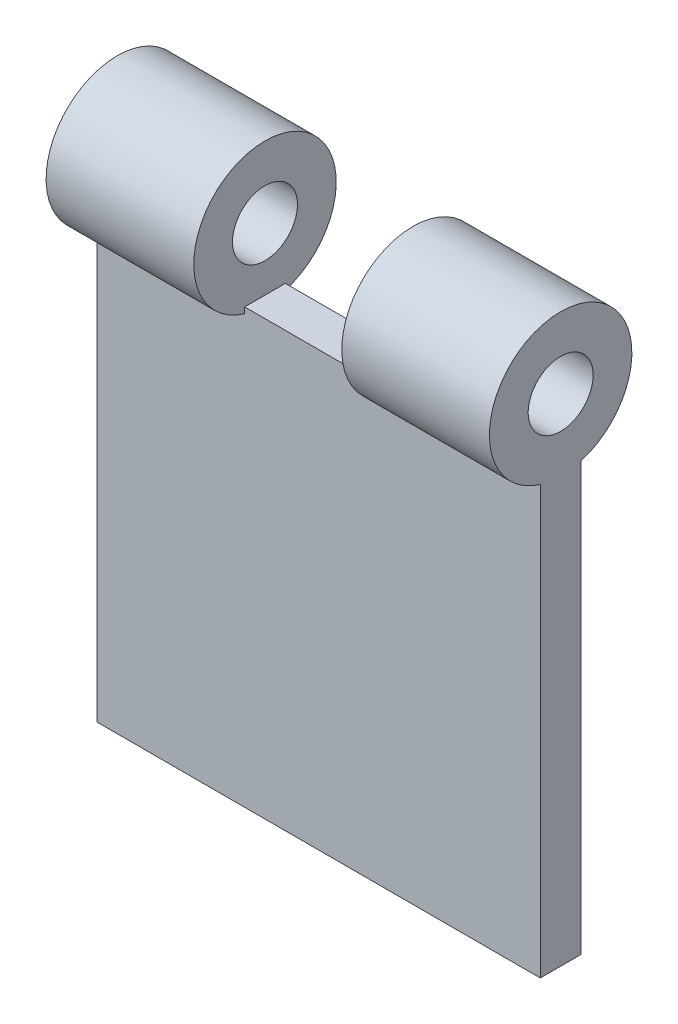
from build123d import *

# Parameters (mm, degrees)
SKETCH1_W           = 24.892
SKETCH1_H           = 7.874
BOSS_EXTRUDE1_DEPTH = 2.286
SKETCH2_R           = 4
BOSS_EXTRUDE2_DEPTH = 8.29
SKETCH3_R           = 1.825
CUT_EXTRUDE1_DEPTH  = 8.29
SKETCH4_R           = 4
BOSS_EXTRUDE3_DEPTH = 8.29
SKETCH5_R           = 1.825
CUT_EXTRUDE2_DEPTH  = 8.29
SKETCH7_W           = 2.286
SKETCH7_H           = 24
BOSS_EXTRUDE4_DEPTH = 24.892


with BuildPart() as part:
    # Sketch1 → Boss-Extrude1 (new body)
    with BuildSketch(Plane.XY):
        with Locations((-11.83196875, 3.65678125)):
            Rectangle(SKETCH1_W, SKETCH1_H)
    extrude(amount=BOSS_EXTRUDE1_DEPTH)

    # Sketch4 → Boss-Extrude3 (add)
    with BuildSketch(Plane.ZY.offset(24.27796875)):
        with Locations(Location((1.143, 11.09378125, 0), (0, 0, 90))):
            Circle(SKETCH4_R)
    extrude(amount=-BOSS_EXTRUDE3_DEPTH)

    # Sketch5 → Cut-Extrude2 (cut)
    with BuildSketch(Plane.ZY.offset(24.27796875)):
        with Locations(Location((1.143, 11.09378125, 0), (0, 0, 90))):
            Circle(SKETCH5_R)
    extrude(amount=-CUT_EXTRUDE2_DEPTH, mode=Mode.SUBTRACT)



with BuildPart() as body_2:
    # Sketch2 → Boss-Extrude2 (new body)
    with BuildSketch(Plane(origin=(0.61403125, 0, 0), x_dir=(0, 0, -1), z_dir=(1, 0, 0))):
        with Locations(Location((-1.143, 11.09378125, 0), (0, 0, 90))):
            Circle(SKETCH2_R)
    extrude(amount=-BOSS_EXTRUDE2_DEPTH)

    # Sketch3 → Cut-Extrude1 (cut)
    with BuildSketch(Plane(origin=(0.61403125, 0, 0), x_dir=(0, 0, -1), z_dir=(1, 0, 0))):
        with Locations(Location((-1.143, 11.09378125, 0), (0, 0, 90))):
            Circle(SKETCH3_R)
    extrude(amount=-CUT_EXTRUDE1_DEPTH, mode=Mode.SUBTRACT)


with BuildPart() as part_1:
    add(part.part)

    add(body_2.part)  # Boss-Extrude4 merges body 2
    # Sketch7 → Boss-Extrude4 (add)
    with BuildSketch(Plane.ZY.offset(24.27796875)):
        with Locations((1.143, -4.739435545)):
            Rectangle(SKETCH7_W, SKETCH7_H)
    extrude(amount=-BOSS_EXTRUDE4_DEPTH)


solid = part_1.part
